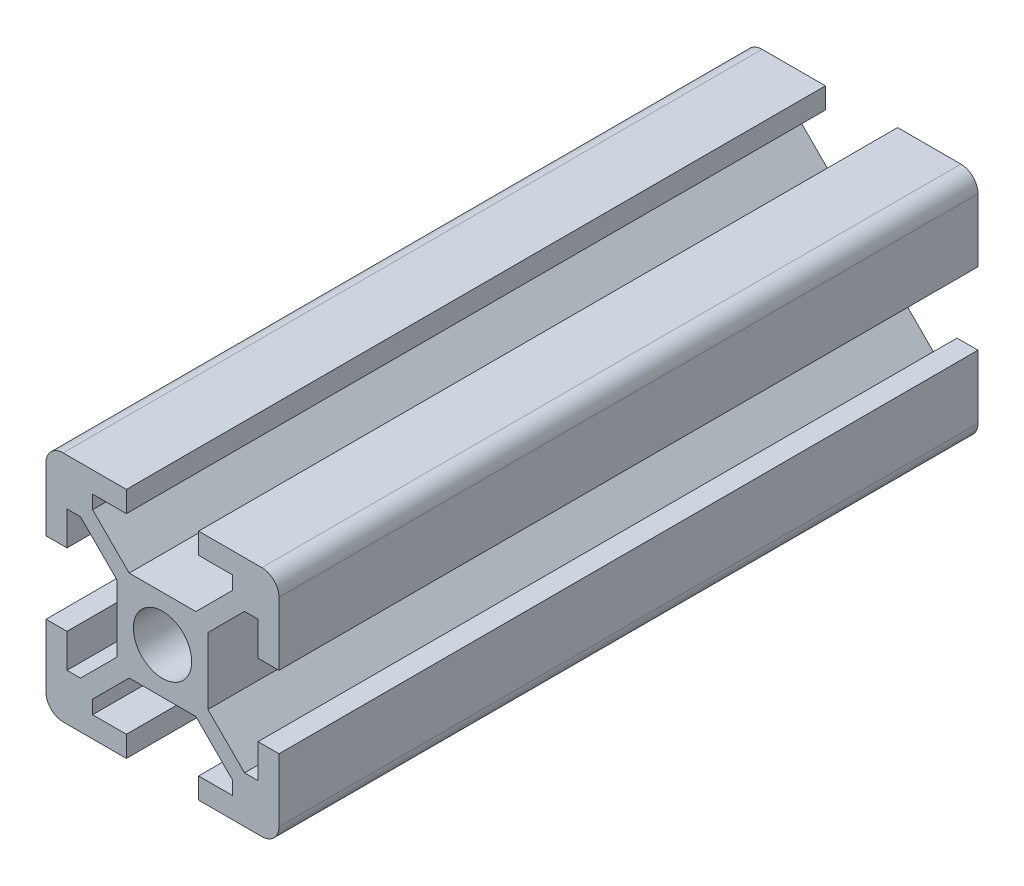
from build123d import *

# Parameters (mm, degrees)
SKETCH1_R           = 2.5
BOSS_EXTRUDE1_DEPTH = 60
FILLET1_R           = 1.47
SKETCH2_R           = 1.5
CUT_EXTRUDE1_DEPTH  = 63.395592793


with BuildPart() as part:
    # Sketch1 → Boss-Extrude1 (new body)
    with BuildSketch(Plane.XY):
        Polygon((2.860553032, 3.9), (6, 7.039446968), (6, 8.2), (3.1, 8.2), (3.1, 10), (10, 10), (10, 3.1), (8.2, 3.1), (8.2, 6), (7.039446968, 6), (3.9, 2.860553032), (3.9, 0), (3.9, -2.860553032), (7.039446968, -6), (8.2, -6), (8.2, -3.1), (10, -3.1), (10, -10), (3.1, -10), (3.1, -8.2), (6, -8.2), (6, -7.039446968), (2.860553032, -3.9), (0, -3.9), (-2.860553032, -3.9), (-6, -7.039446968), (-6, -8.2), (-3.1, -8.2), (-3.1, -10), (-10, -10), (-10, -3.1), (-8.2, -3.1), (-8.2, -6), (-7.039446968, -6), (-3.9, -2.860553032), (-3.9, 0), (-3.9, 2.860553032), (-7.039446968, 6), (-8.2, 6), (-8.2, 3.1), (-10, 3.1), (-10, 10), (-3.1, 10), (-3.1, 8.2), (-6, 8.2), (-6, 7.039446968), (-2.860553032, 3.9), (0, 3.9), align=None)
        Circle(SKETCH1_R, mode=Mode.SUBTRACT)
    extrude(amount=BOSS_EXTRUDE1_DEPTH)

    # Fillet1
    fillet1_edges = [part.edges().sort_by_distance(p)[0] for p in [
        (10, -10, 30),
        (-10, -10, 30),
        (-10, 10, 30),
        (10, 10, 30),
    ]]
    fillet(fillet1_edges, radius=FILLET1_R)

    # Sketch2 → Cut-Extrude1 (cut, through all)
    with BuildSketch(Plane(origin=(3.9, 0, 0), x_dir=(0, 0, -1), z_dir=(1, 0, 0))):
        with Locations(Location((-50, 0, 0), (0, 0, 90))):
            Circle(SKETCH2_R)
        with Locations(Location((-40, 0, 0), (0, 0, 90))):
            Circle(SKETCH2_R)
        with Locations(Location((-30, 0, 0), (0, 0, 90))):
            Circle(SKETCH2_R)
        with Locations(Location((-20, 0, 0), (0, 0, 90))):
            Circle(SKETCH2_R)
    extrude(amount=-CUT_EXTRUDE1_DEPTH, mode=Mode.SUBTRACT)


solid = part.part
